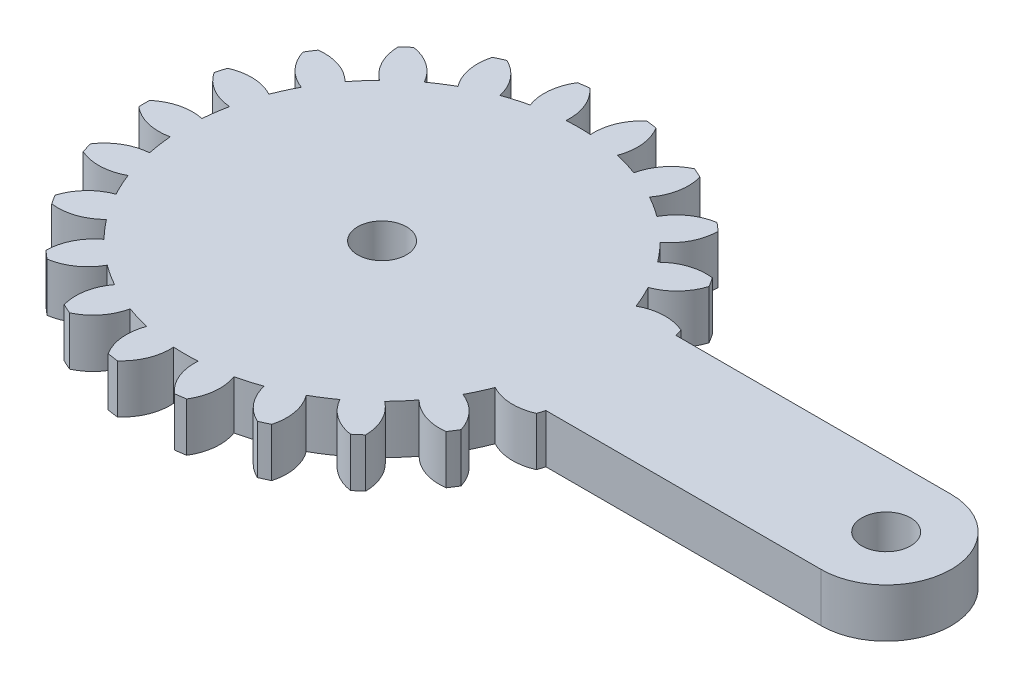
from build123d import *

# Parameters (mm, degrees)
IZIM2_R                     = 14.63
IZIM2_R_2                   = 1.5
Y_KSEKLIK_EKSTR_ZYON1_DEPTH = 3
KES_EKSTR_ZYON1_START       = -3
KES_EKSTR_ZYON1_DEPTH       = 3
DAIRESEL_KAPLAMA1_COUNT     = 22
IZIM4_R                     = 1.5
Y_KSEKLIK_EKSTR_ZYON2_DEPTH = 3


with BuildPart() as part:
    # Çizim2 → Yükseklik-Ekstrüzyon1 (new body)
    with BuildSketch(Plane(origin=(0, 0, 0), x_dir=(1, 0, 0), z_dir=(0, 1, 0))):
        with Locations(Location((0, 0, 0), (0, 0, 270))):
            Circle(IZIM2_R)
        with Locations(Location((0, 0, 0), (0, 0, 270))):
            Circle(IZIM2_R_2, mode=Mode.SUBTRACT)
    extrude(amount=Y_KSEKLIK_EKSTR_ZYON1_DEPTH)

    # Çizim3 → Kes-Ekstrüzyon1 (cut)
    with BuildSketch(Plane(origin=(0, 3, 0), x_dir=(1, 0, 0), z_dir=(0, 1, 0)).offset(KES_EKSTR_ZYON1_START)):
        with BuildLine():
            ThreePointArc((0.75, 12.066714549), (0, 12.09), (-0.75, 12.066714549))
            ThreePointArc((-0.75, 12.066714549), (-0.963393925, 13.412425983), (-1.75, 14.524957831))
            ThreePointArc((-1.75, 14.524957831), (0, 14.63), (1.75, 14.524957831))
            ThreePointArc((1.75, 14.524957831), (0.963393925, 13.412425983), (0.75, 12.066714549))
        make_face()
    kes_ekstr_zyon1 = extrude(amount=KES_EKSTR_ZYON1_DEPTH, mode=Mode.SUBTRACT)

    # Dairesel Kaplama1: Kes-Ekstrüzyon1 ×22 about axis
    dairesel_kaplama1_axis = Axis((0, 0, 0), (0, 1, 0))
    for i in range(1, DAIRESEL_KAPLAMA1_COUNT):
        add(kes_ekstr_zyon1.rotate(dairesel_kaplama1_axis, i * 360 / DAIRESEL_KAPLAMA1_COUNT), mode=Mode.SUBTRACT)

    # Çizim4 → Yükseklik-Ekstrüzyon2 (add)
    with BuildSketch(Plane(origin=(0, 3, 0), x_dir=(1, 0, 0), z_dir=(0, 1, 0))):
        with BuildLine():
            Line((31, 4), (4.554699728, 4))
            Line((4.554699728, 4), (4.554699728, -4))
            Line((4.554699728, -4), (31, -4))
            ThreePointArc((31, -4), (35, 0), (31, 4))
        make_face()
        with Locations(Location((31, 0, 0), (0, 0, 270))):
            Circle(IZIM4_R, mode=Mode.SUBTRACT)
    extrude(amount=-Y_KSEKLIK_EKSTR_ZYON2_DEPTH)


solid = part.part
